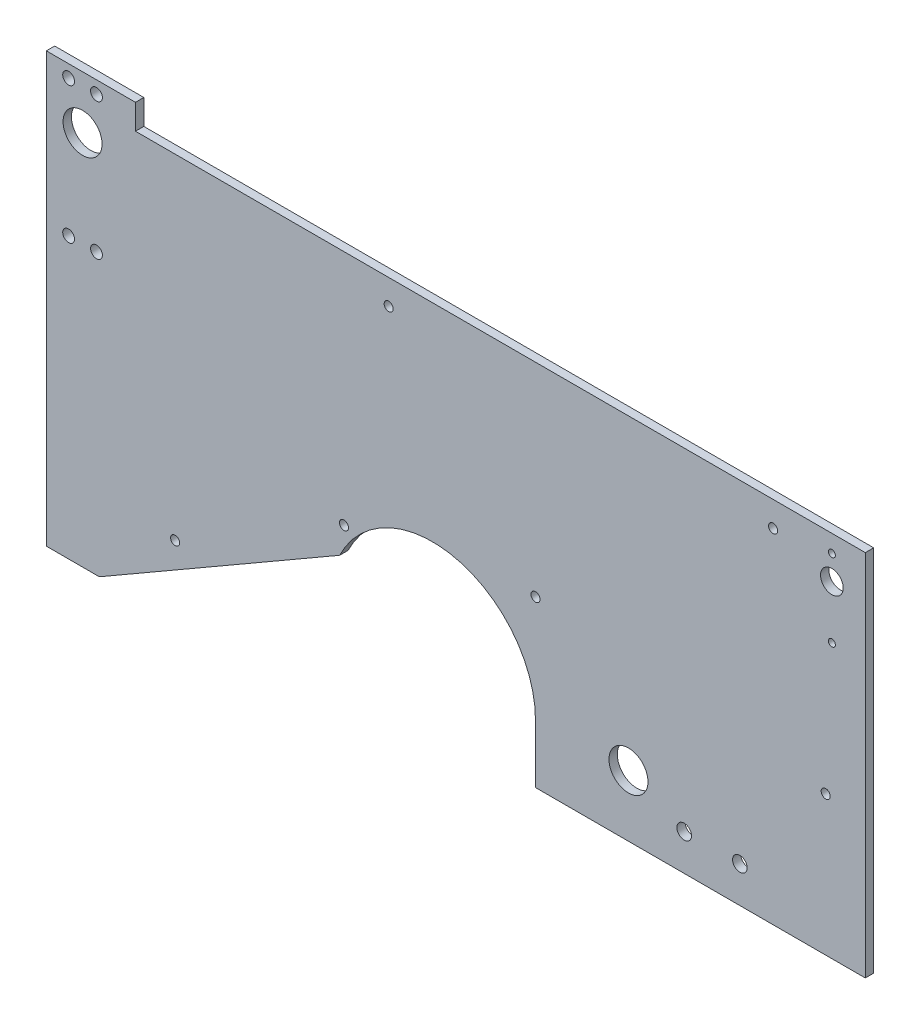
from build123d import *

# Parameters (mm, degrees)
SKETCH2_R           = 7
SKETCH2_R_2         = 2.125
BOSS_EXTRUDE2_DEPTH = 3
SKETCH3_W           = 118.4
SKETCH3_H           = 12.75
CUT_EXTRUDE1_DEPTH  = 338.231374578
SKETCH5_R           = 2.625
SKETCH5_R_2         = 4.075
SKETCH5_R_3         = 1.25
SKETCH5_R_4         = 1.625
SKETCH5_R_5         = 7
SKETCH5_W           = 6
SKETCH5_H           = 154
CUT_EXTRUDE2_DEPTH  = 338.231374578


with BuildPart() as part:
    # Sketch2 → Boss-Extrude2 (new body)
    with BuildSketch(Plane.XY):
        with BuildLine():
            Line((25.03035901, 0), (111.286489227, 49.8))
            ThreePointArc((111.286489227, 49.8), (152.858332199, 69.766604349), (181.6, 33.7))
            Line((181.6, 33.7), (181.6, 0))
            Line((181.6, 0), (300, 0))
            Line((300, 0), (300, 145))
            Line((300, 145), (38, 145))
            Line((38, 145), (38, 154))
            Line((38, 154), (19, 154))
            Line((19, 154), (0, 154))
            Line((0, 154), (0, 0))
            Line((0, 0), (25.03035901, 0))
        make_face()
        with Locations((19, 135)):
            Circle(SKETCH2_R, mode=Mode.SUBTRACT)
        with Locations((14, 149.5)):
            Circle(SKETCH2_R_2, mode=Mode.SUBTRACT)
        with Locations(Location((24, 149.5, 0), (0, 0, 180))):
            Circle(SKETCH2_R_2, mode=Mode.SUBTRACT)
        with Locations((24, 100.5)):
            Circle(SKETCH2_R_2, mode=Mode.SUBTRACT)
        with Locations((14, 100.5)):
            Circle(SKETCH2_R_2, mode=Mode.SUBTRACT)
    extrude(amount=BOSS_EXTRUDE2_DEPTH)

    # Sketch3 → Cut-Extrude1 (cut, through all)
    with BuildSketch(Plane.XY.offset(3)):
        with Locations((240.8, 6.375)):
            Rectangle(SKETCH3_W, SKETCH3_H)
    extrude(amount=-CUT_EXTRUDE1_DEPTH, mode=Mode.SUBTRACT)

    # Sketch5 → Cut-Extrude2 (cut, through all)
    with BuildSketch(Plane.XY.offset(3)):
        with Locations((254.98, 25.75)):
            Circle(SKETCH5_R)
        with Locations((234.98, 25.75)):
            Circle(SKETCH5_R)
        with Locations((288, 130)):
            Circle(SKETCH5_R_2)
        with Locations((288, 138.75)):
            Circle(SKETCH5_R_3)
        with Locations((288, 110.95)):
            Circle(SKETCH5_R_3)
        with Locations((285.78, 62.92)):
            Circle(SKETCH5_R_4)
        with Locations((181.6, 72.03)):
            Circle(SKETCH5_R_4)
        with Locations((52.23, 24.91)):
            Circle(SKETCH5_R_4)
        with Locations((112.84, 59.93)):
            Circle(SKETCH5_R_4)
        with Locations((266.895, 135.995)):
            Circle(SKETCH5_R_4)
        with Locations((128.895, 135.995)):
            Circle(SKETCH5_R_4)
        with Locations((214.98, 34.75)):
            Circle(SKETCH5_R_5)
        with Locations((3, 77)):
            Rectangle(SKETCH5_W, SKETCH5_H)
    extrude(amount=-CUT_EXTRUDE2_DEPTH, mode=Mode.SUBTRACT)


solid = part.part
